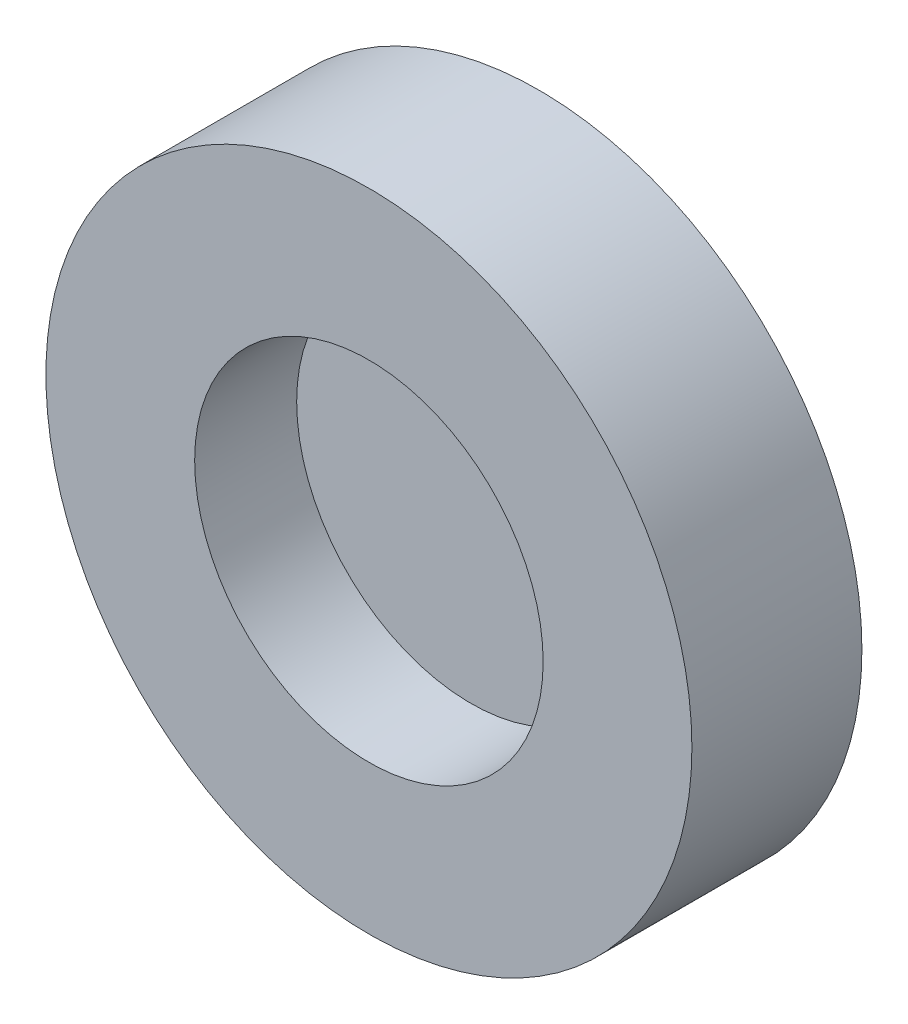
from build123d import *

# Parameters (mm, degrees)
ESQUISSE1_R        = 19
ESQUISSE1_R_2      = 10.25
BOSS_EXTRU_1_DEPTH = 10
ESQUISSE2_R        = 10.25
BOSS_EXTRU_2_DEPTH = 4


with BuildPart() as part:
    # Esquisse1 → Boss.-Extru.1 (new body)
    with BuildSketch(Plane.XY):
        Circle(ESQUISSE1_R)
        Circle(ESQUISSE1_R_2, mode=Mode.SUBTRACT)
    extrude(amount=BOSS_EXTRU_1_DEPTH)

    # Esquisse2 → Boss.-Extru.2 (add)
    with BuildSketch(Plane(origin=(0, 0, 0), x_dir=(-1, 0, 0), z_dir=(0, 0, -1))):
        Circle(ESQUISSE2_R)
    extrude(amount=-BOSS_EXTRU_2_DEPTH)


solid = part.part
